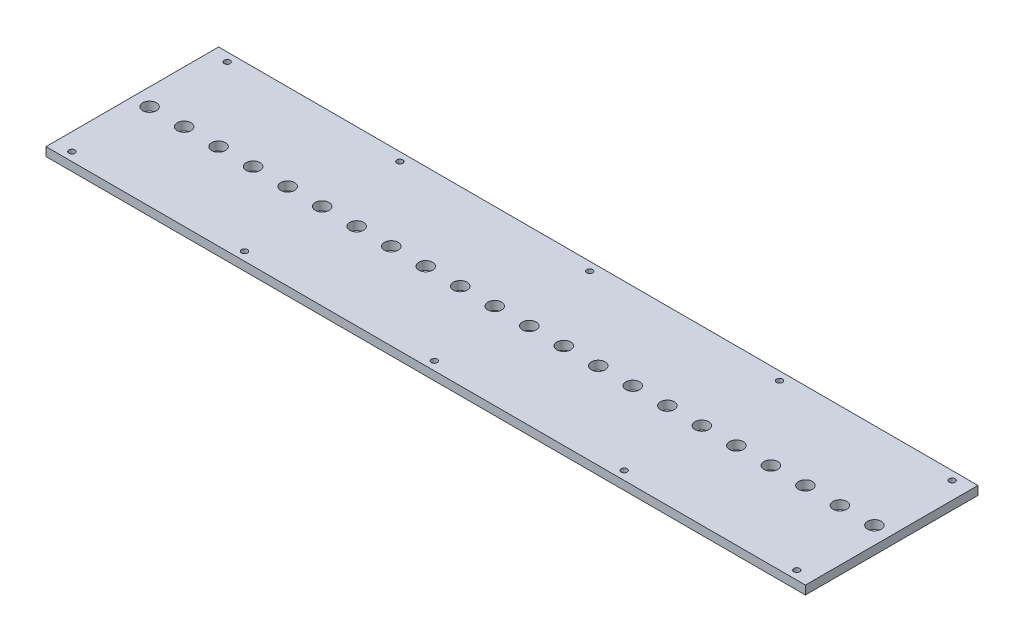
from build123d import *

# Parameters (mm, degrees)
SKETCH2_W           = 558.8
SKETCH2_H           = 127
SKETCH2_R           = 5.08
BOSS_EXTRUDE1_DEPTH = 6.35
SKETCH3_R           = 2.1828125
CUT_EXTRUDE1_DEPTH  = 6.35


with BuildPart() as part:
    # Sketch2 → Boss-Extrude1 (new body)
    with BuildSketch(Plane(origin=(0, 0, 0), x_dir=(1, 0, 0), z_dir=(0, 1, 0))):
        with Locations((279.4, 63.5)):
            Rectangle(SKETCH2_W, SKETCH2_H)
        with Locations(Location((12.7, 63.5, 0), (0, 0, 270))):
            Circle(SKETCH2_R, mode=Mode.SUBTRACT)
        with Locations(Location((38.1, 63.5, 0), (0, 0, 270))):
            Circle(SKETCH2_R, mode=Mode.SUBTRACT)
        with Locations(Location((63.5, 63.5, 0), (0, 0, 270))):
            Circle(SKETCH2_R, mode=Mode.SUBTRACT)
        with Locations(Location((88.9, 63.5, 0), (0, 0, 270))):
            Circle(SKETCH2_R, mode=Mode.SUBTRACT)
        with Locations(Location((114.3, 63.5, 0), (0, 0, 270))):
            Circle(SKETCH2_R, mode=Mode.SUBTRACT)
        with Locations(Location((139.7, 63.5, 0), (0, 0, 270))):
            Circle(SKETCH2_R, mode=Mode.SUBTRACT)
        with Locations(Location((165.1, 63.5, 0), (0, 0, 270))):
            Circle(SKETCH2_R, mode=Mode.SUBTRACT)
        with Locations(Location((190.5, 63.5, 0), (0, 0, 270))):
            Circle(SKETCH2_R, mode=Mode.SUBTRACT)
        with Locations(Location((215.9, 63.5, 0), (0, 0, 270))):
            Circle(SKETCH2_R, mode=Mode.SUBTRACT)
        with Locations(Location((241.3, 63.5, 0), (0, 0, 270))):
            Circle(SKETCH2_R, mode=Mode.SUBTRACT)
        with Locations(Location((266.7, 63.5, 0), (0, 0, 270))):
            Circle(SKETCH2_R, mode=Mode.SUBTRACT)
        with Locations(Location((292.1, 63.5, 0), (0, 0, 270))):
            Circle(SKETCH2_R, mode=Mode.SUBTRACT)
        with Locations(Location((317.5, 63.5, 0), (0, 0, 270))):
            Circle(SKETCH2_R, mode=Mode.SUBTRACT)
        with Locations(Location((342.9, 63.5, 0), (0, 0, 270))):
            Circle(SKETCH2_R, mode=Mode.SUBTRACT)
        with Locations(Location((368.3, 63.5, 0), (0, 0, 270))):
            Circle(SKETCH2_R, mode=Mode.SUBTRACT)
        with Locations(Location((393.7, 63.5, 0), (0, 0, 270))):
            Circle(SKETCH2_R, mode=Mode.SUBTRACT)
        with Locations(Location((419.1, 63.5, 0), (0, 0, 270))):
            Circle(SKETCH2_R, mode=Mode.SUBTRACT)
        with Locations(Location((444.5, 63.5, 0), (0, 0, 270))):
            Circle(SKETCH2_R, mode=Mode.SUBTRACT)
        with Locations(Location((469.9, 63.5, 0), (0, 0, 270))):
            Circle(SKETCH2_R, mode=Mode.SUBTRACT)
        with Locations(Location((495.3, 63.5, 0), (0, 0, 270))):
            Circle(SKETCH2_R, mode=Mode.SUBTRACT)
        with Locations(Location((520.7, 63.5, 0), (0, 0, 270))):
            Circle(SKETCH2_R, mode=Mode.SUBTRACT)
        with Locations(Location((546.1, 63.5, 0), (0, 0, 270))):
            Circle(SKETCH2_R, mode=Mode.SUBTRACT)
    extrude(amount=BOSS_EXTRUDE1_DEPTH)

    # Sketch3 → Cut-Extrude1 (cut)
    with BuildSketch(Plane(origin=(0, 6.35, 0), x_dir=(1, 0, 0), z_dir=(0, 1, 0))):
        with Locations(Location((12.7, 120.65, 0), (0, 0, 270))):
            Circle(SKETCH3_R)
        with Locations(Location((139.7, 120.65, 0), (0, 0, 270))):
            Circle(SKETCH3_R)
        with Locations(Location((279.4, 120.65, 0), (0, 0, 270))):
            Circle(SKETCH3_R)
        with Locations(Location((419.1, 120.65, 0), (0, 0, 270))):
            Circle(SKETCH3_R)
        with Locations(Location((546.1, 120.65, 0), (0, 0, 270))):
            Circle(SKETCH3_R)
        with Locations(Location((546.1, 6.35, 0), (0, 0, 270))):
            Circle(SKETCH3_R)
        with Locations(Location((419.1, 6.35, 0), (0, 0, 270))):
            Circle(SKETCH3_R)
        with Locations(Location((279.4, 6.35, 0), (0, 0, 270))):
            Circle(SKETCH3_R)
        with Locations(Location((139.7, 6.35, 0), (0, 0, 270))):
            Circle(SKETCH3_R)
        with Locations(Location((12.7, 6.35, 0), (0, 0, 270))):
            Circle(SKETCH3_R)
    extrude(amount=-CUT_EXTRUDE1_DEPTH, mode=Mode.SUBTRACT)


solid = part.part
